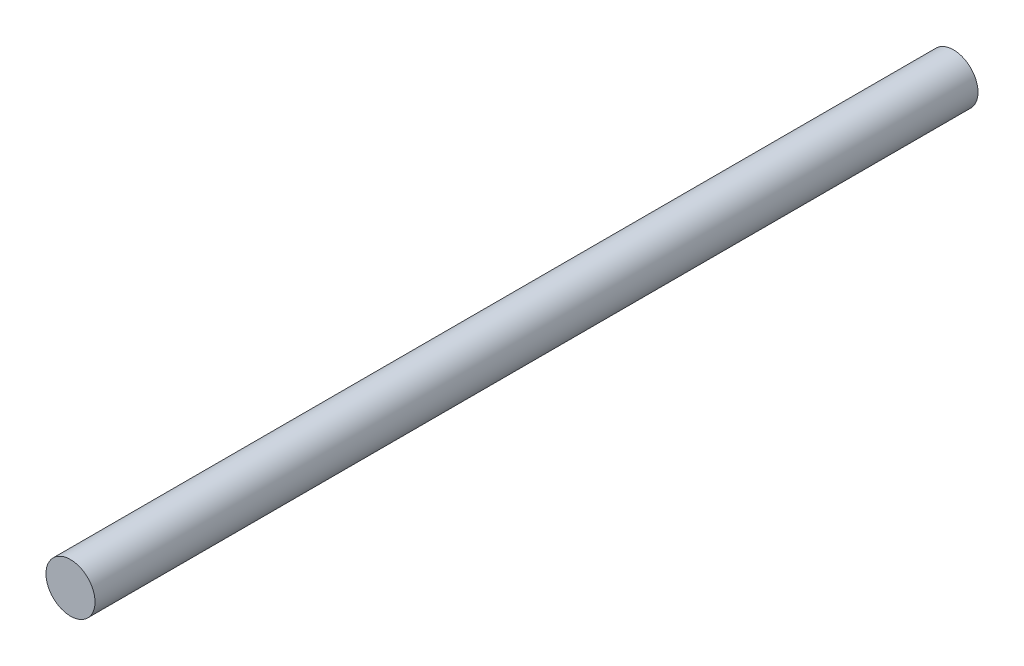
from build123d import *

# Parameters (mm, degrees)
SKETCH2_R           = 6.35
BOSS_EXTRUDE1_DEPTH = 228.6


with BuildPart() as part:
    # Sketch2 → Boss-Extrude1 (new body)
    with BuildSketch(Plane.XY):
        Circle(SKETCH2_R)
    extrude(amount=BOSS_EXTRUDE1_DEPTH)


solid = part.part
